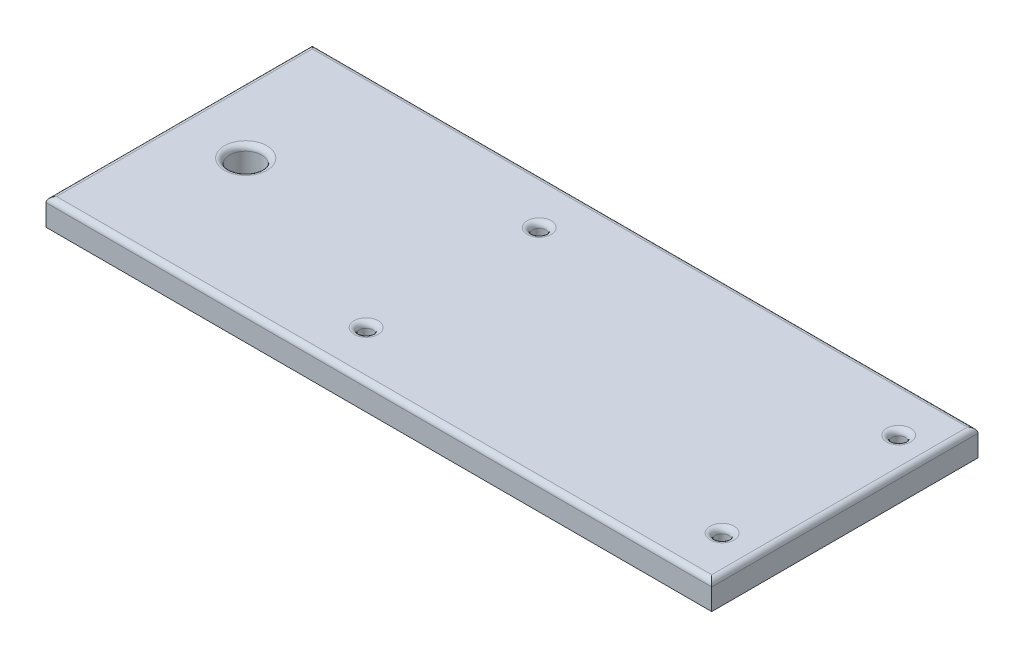
from build123d import *

# Parameters (mm, degrees)
SKETCH1_W           = 6350
SKETCH1_H           = 2540
SKETCH1_R           = 152.4
SKETCH1_R_2         = 63.5
BOSS_EXTRUDE1_DEPTH = 254
FILLET1_R           = 50.8


with BuildPart() as part:
    # Sketch1 → Boss-Extrude1 (new body)
    with BuildSketch(Plane(origin=(0, 0, 0), x_dir=(1, 0, 0), z_dir=(0, 1, 0))):
        Rectangle(SKETCH1_W, SKETCH1_H)
        with Locations(Location((-2540, 0, 0), (0, 0, 270))):
            Circle(SKETCH1_R, mode=Mode.SUBTRACT)
        with Locations(Location((-565.912, 825.5, 0), (0, 0, 270))):
            Circle(SKETCH1_R_2, mode=Mode.SUBTRACT)
        with Locations(Location((-565.912, -825.5, 0), (0, 0, 270))):
            Circle(SKETCH1_R_2, mode=Mode.SUBTRACT)
        with Locations(Location((2829.700460829, -825.5, 0), (0, 0, 270))):
            Circle(SKETCH1_R_2, mode=Mode.SUBTRACT)
        with Locations(Location((2863.088, 825.5, 0), (0, 0, 270))):
            Circle(SKETCH1_R_2, mode=Mode.SUBTRACT)
    extrude(amount=BOSS_EXTRUDE1_DEPTH)

    # Fillet1
    fillet1_edges = [part.edges().sort_by_distance(p)[0] for p in [
        (-2540, 254, -152.4),
        (-3175, 254, 0),
        (-565.912, 254, -889),
        (0, 254, 1270),
        (-565.912, 0, 762),
        (-565.912, 254, 762),
        (2829.700460829, 254, 762),
        (2863.088, 254, -889),
        (3175, 254, 0),
        (0, 254, -1270),
    ]]
    fillet(fillet1_edges, radius=FILLET1_R)


solid = part.part
